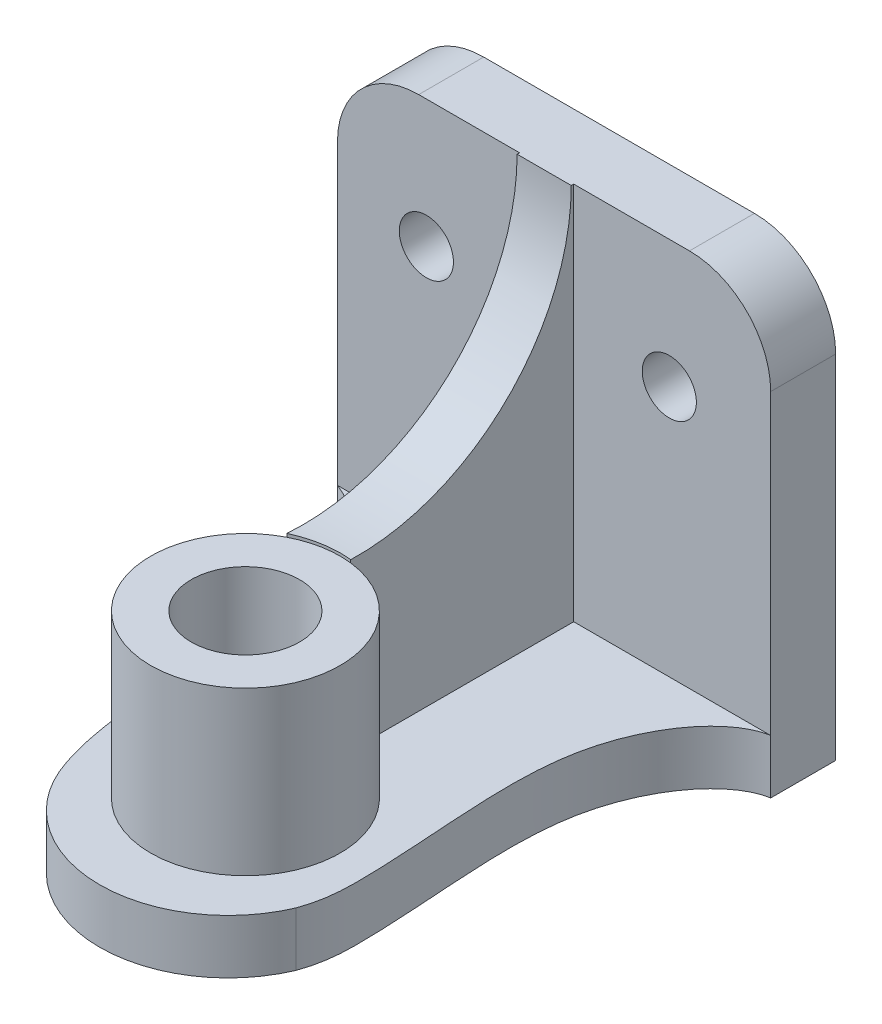
from build123d import *

# Parameters (mm, degrees)
BOSS_EXTRUDE2_DEPTH      = 10
CUT_EXTRUDE_THIN1_DEPTH  = 10
SKETCH5_R                = 17.5
SKETCH5_R_2              = 10
BOSS_EXTRUDE3_DEPTH      = 30
SKETCH7_W                = 80
SKETCH7_H                = 80
BOSS_EXTRUDE4_DEPTH      = 12
FILLET2_R                = 15
BOSS_EXTRUDE5_REACH      = 144.014
BOSS_EXTRUDE5_END_RADIUS = 17.5
SKETCH8_W                = 10
SKETCH8_H                = 70
SKETCH9_R                = 39.5
CUT_EXTRUDE1_DEPTH       = 12
F_10_0MM_DOWEL_SLOT1_D   = 10


with BuildPart() as part:
    # Sketch3 → Boss-Extrude2 (new body)
    with BuildSketch(Plane(origin=(0, 0, 0), x_dir=(1, 0, 0), z_dir=(0, 1, 0))):
        with BuildLine():
            Line((0, 0), (80, 0))
            add(Edge.make_bspline(
                [(0, 0), (9.568772754, -3.662252769), (13.233792617, -26.367514399), (14.892974138, -48.26173719), (19.457625693, -73.382546531), (29.234028115, -88.842620539), (47.339429681, -94.978505807), (65.072681899, -76.355870434), (65.472290622, -49.499797191), (60.330152399, -17.820535728), (73.673313223, -1.004614773), (80, 0)],
                knots=[0, 0, 0, 0, 0.130431735, 0.366934607, 0.413509275, 0.549603742, 0.580090258, 0.687887922, 0.718701469, 0.85741218, 1, 1, 1, 1], degree=3))
        make_face()
    extrude(amount=BOSS_EXTRUDE2_DEPTH)

    # Sketch4 → Cut-Extrude-Thin1 (cut)
    with BuildSketch(Plane(origin=(0, 10, 0), x_dir=(1, 0, 0), z_dir=(0, 1, 0))):
        Polygon((7.236393203, -67.338737313), (6.633563606, -66.218935394), (15.43873628, -61.47879466), (16.041565876, -62.598596579), align=None)
        with BuildLine():
            ThreePointArc((20.05548635, -71.393733338), (41.904058586, -85.836536546), (63.752630822, -71.393733338))
            Line((63.752630822, -71.393733338), (72.953082149, -75.311857301))
            ThreePointArc((72.953082149, -75.311857301), (41.904058586, -95.836536546), (10.855035023, -75.311857301))
            Line((10.855035023, -75.311857301), (20.05548635, -71.393733338))
        make_face()
    extrude(amount=-CUT_EXTRUDE_THIN1_DEPTH, mode=Mode.SUBTRACT)

    # Sketch5 → Boss-Extrude3 (add)
    with BuildSketch(Plane(origin=(0, 10, 0), x_dir=(1, 0, 0), z_dir=(0, 1, 0))):
        with Locations(Location((41.563187494, -58.566374958, 0), (0, 0, 270))):
            Circle(SKETCH5_R)
        with Locations(Location((41.563187494, -58.566374958, 0), (0, 0, 270))):
            Circle(SKETCH5_R_2, mode=Mode.SUBTRACT)
    extrude(amount=BOSS_EXTRUDE3_DEPTH)

    # Sketch7 → Boss-Extrude4 (add)
    with BuildSketch(Plane(origin=(0, 0, 0), x_dir=(-1, 0, 0), z_dir=(0, 0, -1))):
        with Locations((-40, 40)):
            Rectangle(SKETCH7_W, SKETCH7_H)
    extrude(amount=BOSS_EXTRUDE4_DEPTH)

    # Fillet2
    fillet2_edges = [part.edges().sort_by_distance(p)[0] for p in [
        (80, 80, -6),
        (0, 80, -6),
    ]]
    fillet(fillet2_edges, radius=FILLET2_R)

    # Boss-Extrude5: up to this cylinder (the profile starts outside it)
    boss_extrude5_end = Plane(origin=(41.563187494, 45, 58.566374958), z_dir=(0, -1, 0)) * Cylinder(BOSS_EXTRUDE5_END_RADIUS, 324.028, mode=Mode.PRIVATE)
    # Sketch8 → Boss-Extrude5 (add, up to the surface)
    with BuildSketch(Plane.XY, mode=Mode.PRIVATE) as boss_extrude5_sk1:
        with Locations((38.624100389, 45)):
            Rectangle(SKETCH8_W, SKETCH8_H)
    boss_extrude5_tool1 = extrude(boss_extrude5_sk1.sketch, amount=BOSS_EXTRUDE5_REACH, mode=Mode.PRIVATE) - boss_extrude5_end
    add(boss_extrude5_tool1.solids().sort_by_distance((38.6241, 45, 0))[0])

    # Sketch9 → Cut-Extrude1 (cut)
    with BuildSketch(Plane.ZY.offset(-33.624100389)):
        with Locations((39.952210093, 80)):
            Circle(SKETCH9_R)
    extrude(amount=-CUT_EXTRUDE1_DEPTH, mode=Mode.SUBTRACT)

    # Ø10.0mm Dowel Slot1 (through all)
    with Locations(Plane.XY):
        with Locations((61.279203802, 56.41280999), (16.414291642, 56.41280999)):
            Hole(F_10_0MM_DOWEL_SLOT1_D / 2)


solid = part.part
